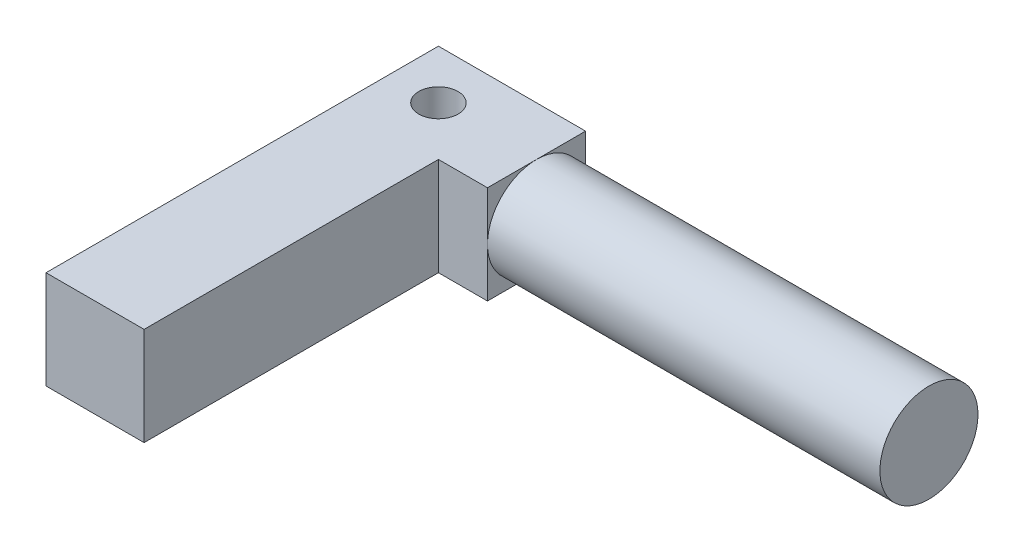
from build123d import *

# Parameters (mm, degrees)
BOSS_EXTRUDE2_DEPTH = 50
SKETCH2_R           = 10
CUT_EXTRUDE1_DEPTH  = 189.745860882
SKETCH3_R           = 25
BOSS_EXTRUDE3_DEPTH = 200


with BuildPart() as part:
    # Sketch1 → Boss-Extrude2 (new body)
    with BuildSketch(Plane(origin=(0, 0, 0), x_dir=(1, 0, 0), z_dir=(0, 1, 0))):
        Polygon((-25, 25), (25, 25), (50, 25), (50, -25), (25, -25), (25, -175), (-25, -175), align=None)
    extrude(amount=BOSS_EXTRUDE2_DEPTH)

    # Sketch2 → Cut-Extrude1 (cut, through all)
    with BuildSketch(Plane.XZ):
        with Locations(Location((0, 0, 0), (0, 0, 270))):
            Circle(SKETCH2_R)
    extrude(amount=-CUT_EXTRUDE1_DEPTH, mode=Mode.SUBTRACT)

    # Sketch3 → Boss-Extrude3 (add)
    with BuildSketch(Plane(origin=(50, 0, 0), x_dir=(0, 0, -1), z_dir=(1, 0, 0))):
        with Locations((0, 25)):
            Circle(SKETCH3_R)
    extrude(amount=BOSS_EXTRUDE3_DEPTH)


solid = part.part
